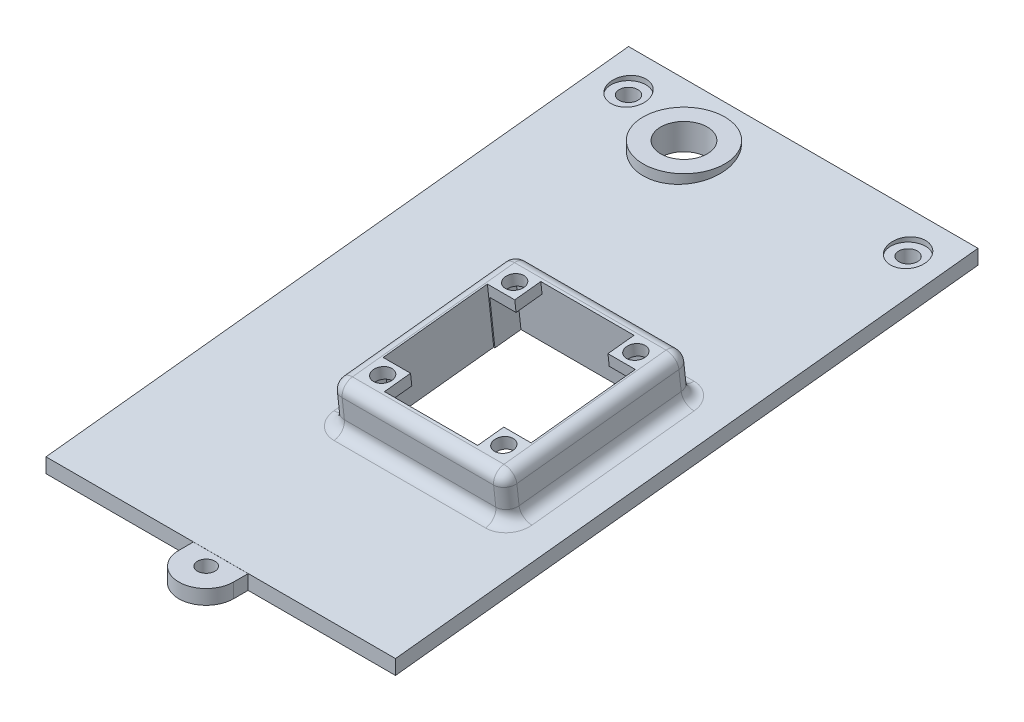
from build123d import *

# Parameters (mm, degrees)
EXTRUDE_1_DEPTH             = 60
EXTRUDE_2_REACH             = 118.966
SKETCH_3_W                  = 7
SKETCH_3_H                  = 7
SKETCH_4_R                  = 1.6
CUT_EXTRUDE_1_DEPTH         = 117.965806969
SKETCH_5_R                  = 3
CUT_EXTRUDE_2_DEPTH         = 1.2
EXTRUDE_3_REACH             = 118.966
SKETCH_6_W                  = 18.446856435
SKETCH_6_H                  = 14
SKETCH_7_W                  = 18.446856435
SKETCH_7_H                  = 2.5
EXTRUDE_4_DEPTH             = 2.5
EXTRUDE_4_DIRECTION_2_REACH = 118.966
SKETCH_8_R                  = 4
CUT_EXTRUDE_3_DEPTH         = 117.965806969
EXTRUDE_5_REACH             = 119.4
SKETCH_9_R                  = 7
SKETCH_11_R                 = 4
CUT_EXTRUDE_5_DEPTH         = 117.965806969
SKETCH_12_W                 = 30
SKETCH_12_H                 = 32
EXTRUDE_6_DEPTH             = 7.5
SKETCH_13_W                 = 25
SKETCH_13_H                 = 27
CUT_EXTRUDE_6_DEPTH         = 120.314910243
SKETCH_14_W                 = 4.5
SKETCH_14_H                 = 4.5
SKETCH_14_R                 = 1.6
EXTRUDE_7_DEPTH             = 2
FILLET_2_R                  = 2
SKETCH_15_W                 = 25.4
SKETCH_15_H                 = 18
CUT_EXTRUDE_7_DEPTH         = 120.314910243
SKETCH_16_R                 = 1.5
EXTRUDE_8_DEPTH             = 2.5


with BuildPart() as part:
    # 草图2 → 凸台-拉伸1 (new body)
    with BuildSketch(Plane(origin=(0, 0, 0), x_dir=(0, 0, -1), z_dir=(1, 0, 0))):
        Polygon((100, 28), (0, 17), (0, 14.484920478), (100, 25.484920478), align=None)
    extrude(amount=-EXTRUDE_1_DEPTH)

    # 凸台-拉伸2: up to this plane
    extrude_2_end = Plane(origin=(-60, 14.484920478, 0), z_dir=(0, -0.9940043559354329, -0.10934047915289775))
    # 草图3 → 凸台-拉伸2 (add, up to the surface)
    with BuildSketch(Plane(origin=(0, 23.484920478, 0), x_dir=(1, 0, 0), z_dir=(0, 1, 0)), mode=Mode.PRIVATE) as extrude_2_sk1:
        with Locations((-54, 94)):
            Rectangle(SKETCH_3_W, SKETCH_3_H)
    extrude_2_tool1 = split(extrude(extrude_2_sk1.sketch, amount=EXTRUDE_2_REACH, mode=Mode.PRIVATE), bisect_by=extrude_2_end, keep=Keep.BOTH, mode=Mode.PRIVATE)
    add(extrude_2_tool1.solids().sort_by_distance((-54, 23.48492, -94))[0])
    # 草图3 → 凸台-拉伸2 (add, up to the surface)
    with BuildSketch(Plane(origin=(0, 23.484920478, 0), x_dir=(1, 0, 0), z_dir=(0, 1, 0)), mode=Mode.PRIVATE) as extrude_2_sk2:
        with Locations((-6, 94)):
            Rectangle(SKETCH_3_W, SKETCH_3_H)
    extrude_2_tool2 = split(extrude(extrude_2_sk2.sketch, amount=EXTRUDE_2_REACH, mode=Mode.PRIVATE), bisect_by=extrude_2_end, keep=Keep.BOTH, mode=Mode.PRIVATE)
    add(extrude_2_tool2.solids().sort_by_distance((-6, 23.48492, -94))[0])

    # 草图4 → 切除-拉伸1 (cut, through all)
    with BuildSketch(Plane.XZ.offset(-23.484920478)):
        with Locations(Location((-54, -94, 0), (0, 0, 270))):
            Circle(SKETCH_4_R)
        with Locations(Location((-6, -94, 0), (0, 0, 90))):
            Circle(SKETCH_4_R)
    extrude(amount=-CUT_EXTRUDE_1_DEPTH, mode=Mode.SUBTRACT)

    # 草图5 → 切除-拉伸2 (cut)
    with BuildSketch(Plane(origin=(0, 28, 0), x_dir=(1, 0, 0), z_dir=(0, 1, 0))):
        with Locations(Location((-54, 94, 0), (0, 0, 270))):
            Circle(SKETCH_5_R)
        with Locations(Location((-6, 94, 0), (0, 0, 270))):
            Circle(SKETCH_5_R)
    extrude(amount=-CUT_EXTRUDE_2_DEPTH, mode=Mode.SUBTRACT)

    # 凸台-拉伸3: up to this plane
    extrude_3_end = Plane(origin=(-60, 14.484920478, 0), z_dir=(0, -0.9940043559354329, -0.10934047915289775))
    # 草图6 → 凸台-拉伸3 (add, up to the surface)
    with BuildSketch(Plane(origin=(0, 23.484920478, 0), x_dir=(1, 0, 0), z_dir=(0, 1, 0)), mode=Mode.PRIVATE) as extrude_3_sk1:
        with Locations((-41.276571782, 90.4)):
            Rectangle(SKETCH_6_W, SKETCH_6_H)
    extrude_3_tool1 = split(extrude(extrude_3_sk1.sketch, amount=EXTRUDE_3_REACH, mode=Mode.PRIVATE), bisect_by=extrude_3_end, keep=Keep.BOTH, mode=Mode.PRIVATE)
    add(extrude_3_tool1.solids().sort_by_distance((-41.276572, 23.48492, -90.4))[0])

    # 草图7 → 凸台-拉伸4 (add)
    with BuildSketch(Plane.XZ.offset(-23.484920478)):
        with Locations((-41.276571782, -82.75)):
            Rectangle(SKETCH_7_W, SKETCH_7_H)
    extrude(amount=EXTRUDE_4_DEPTH)

    # 草图7 → 凸台-拉伸4 direction 2 (add, up to next)
    with BuildSketch(Plane.XZ.offset(-23.484920478), mode=Mode.PRIVATE) as extrude_4_direction_2_sk1:
        with Locations((-41.276571782, -82.75)):
            Rectangle(SKETCH_7_W, SKETCH_7_H)
    extrude_4_direction_2_tool1 = extrude(extrude_4_direction_2_sk1.sketch, amount=-EXTRUDE_4_DIRECTION_2_REACH, mode=Mode.PRIVATE) - part.part
    add(extrude_4_direction_2_tool1.solids().sort_by_distance((-41.276572, 23.48492, -82.75))[0])

    # 草图8 → 切除-拉伸3 (cut, through all)
    with BuildSketch(Plane.XZ.offset(-23.484920478)):
        with Locations(Location((-41.276571782, -90.8, 0), (0, 0, 270))):
            Circle(SKETCH_8_R)
    extrude(amount=-CUT_EXTRUDE_3_DEPTH, mode=Mode.SUBTRACT)

    # 凸台-拉伸5: up to this plane
    extrude_5_end = Plane(origin=(-60, 28, -100), z_dir=(0, 0.9940043559354329, 0.10934047915289762))
    # 草图9 → 凸台-拉伸5 (add, up to the surface)
    with BuildSketch(Plane(origin=(0, 28, 0), x_dir=(1, 0, 0), z_dir=(0, 1, 0)), mode=Mode.PRIVATE) as extrude_5_sk1:
        with Locations(Location((-41.276571782, 90.8, 0), (0, 0, 270))):
            Circle(SKETCH_9_R)
    extrude_5_tool1 = split(extrude(extrude_5_sk1.sketch, amount=-EXTRUDE_5_REACH, mode=Mode.PRIVATE), bisect_by=extrude_5_end, keep=Keep.BOTH, mode=Mode.PRIVATE)
    add(extrude_5_tool1.solids().sort_by_distance((-41.276572, 28, -90.8))[0])

    # 草图11 → 切除-拉伸5 (cut, through all)
    with BuildSketch(Plane.XZ.offset(-23.484920478)):
        with Locations(Location((-41.276571782, -90.8, 0), (0, 0, 270))):
            Circle(SKETCH_11_R)
    extrude(amount=-CUT_EXTRUDE_5_DEPTH, mode=Mode.SUBTRACT)

    # 草图12 → 凸台-拉伸6 (add)
    with BuildSketch(Plane(origin=(0, 16.796759214, 1.847643513), x_dir=(1, 0, 0), z_dir=(0, 0.994004355935433, 0.10934047915289764))):
        with Locations((-22, 44.46196901)):
            Rectangle(SKETCH_12_W, SKETCH_12_H)
    extrude(amount=EXTRUDE_6_DEPTH)

    # 草图13 → 切除-拉伸6 (cut, through all)
    with BuildSketch(Plane(origin=(0, 24.251791883, 2.667697107), x_dir=(1, 0, 0), z_dir=(0, 0.994004355935433, 0.10934047915289753))):
        with Locations((-22, 44.46196901)):
            Rectangle(SKETCH_13_W, SKETCH_13_H)
    extrude(amount=-CUT_EXTRUDE_6_DEPTH, mode=Mode.SUBTRACT)

    # 草图14 → 凸台-拉伸7 (add)
    # profile 1 of 4: a face of its own
    with BuildSketch(Plane(origin=(0, 24.251791883, 2.667697107), x_dir=(1, 0, 0), z_dir=(0, 0.994004355935433, 0.10934047915289753))):
        with Locations((-32.25, 55.71196901)):
            Rectangle(SKETCH_14_W, SKETCH_14_H)
        with Locations(Location((-32.4, 55.86196901, 0), (0, 0, 270))):
            Circle(SKETCH_14_R, mode=Mode.SUBTRACT)
    # profile 2 of 4: a face of its own
    with BuildSketch(Plane(origin=(0, 24.251791883, 2.667697107), x_dir=(1, 0, 0), z_dir=(0, 0.994004355935433, 0.10934047915289753))):
        with Locations((-32.25, 33.21196901)):
            Rectangle(SKETCH_14_W, SKETCH_14_H)
        with Locations(Location((-32.4, 33.06196901, 0), (0, 0, 90))):
            Circle(SKETCH_14_R, mode=Mode.SUBTRACT)
    # profile 3 of 4: a face of its own
    with BuildSketch(Plane(origin=(0, 24.251791883, 2.667697107), x_dir=(1, 0, 0), z_dir=(0, 0.994004355935433, 0.10934047915289753))):
        with Locations((-11.75, 33.21196901)):
            Rectangle(SKETCH_14_W, SKETCH_14_H)
        with Locations(Location((-11.6, 33.06196901, 0), (0, 0, 270))):
            Circle(SKETCH_14_R, mode=Mode.SUBTRACT)
    # profile 4 of 4: a face of its own
    with BuildSketch(Plane(origin=(0, 24.251791883, 2.667697107), x_dir=(1, 0, 0), z_dir=(0, 0.994004355935433, 0.10934047915289753))):
        with Locations((-11.75, 55.71196901)):
            Rectangle(SKETCH_14_W, SKETCH_14_H)
        with Locations(Location((-11.6, 55.86196901, 0), (0, 0, 90))):
            Circle(SKETCH_14_R, mode=Mode.SUBTRACT)
    extrude(amount=-EXTRUDE_7_DEPTH)

    # 圆角2
    fillet_2_edges = [part.edges().sort_by_distance(p)[0] for p in [
        (-7, 21.658252209, -42.347747356),
        (-7, 23.636320877, -26.033650864),
        (-22, 23.407699876, -58.251817051),
        (-7, 27.13521621, -57.841790254),
        (-37, 21.658252209, -42.347747356),
        (-37, 27.13521621, -57.841790254),
        (-22, 19.908804543, -26.443677661),
        (-37, 23.636320877, -26.033650864),
        (-7, 29.113284879, -41.527693762),
        (-22, 30.862732545, -57.431763457),
        (-37, 29.113284879, -41.527693762),
        (-22, 27.363837212, -25.623624067),
    ]]
    fillet(fillet_2_edges, radius=FILLET_2_R)

    # 草图15 → 切除-拉伸7 (cut, through all)
    with BuildSketch(Plane(origin=(0, 24.251791883, 2.667697107), x_dir=(1, 0, 0), z_dir=(0, 0.994004355935433, 0.10934047915289753))):
        with Locations((-22, 44.46196901)):
            Rectangle(SKETCH_15_W, SKETCH_15_H)
    extrude(amount=-CUT_EXTRUDE_7_DEPTH, mode=Mode.SUBTRACT)

    # 草图16 → 凸台-拉伸8 (add)
    with BuildSketch(Plane(origin=(0, 14.484920478, 0), x_dir=(1, 0, 0), z_dir=(0, 1, 0))):
        with BuildLine():
            Line((-34.7, -2.5), (-34.7, 0))
            Line((-34.7, 0), (-25.3, 0))
            Line((-25.3, 0), (-25.3, -2.5))
            ThreePointArc((-25.3, -2.5), (-30, -7.2), (-34.7, -2.5))
        make_face()
        with Locations(Location((-30, -2.5, 0), (0, 0, 270))):
            Circle(SKETCH_16_R, mode=Mode.SUBTRACT)
    extrude(amount=EXTRUDE_8_DEPTH)


solid = part.part
